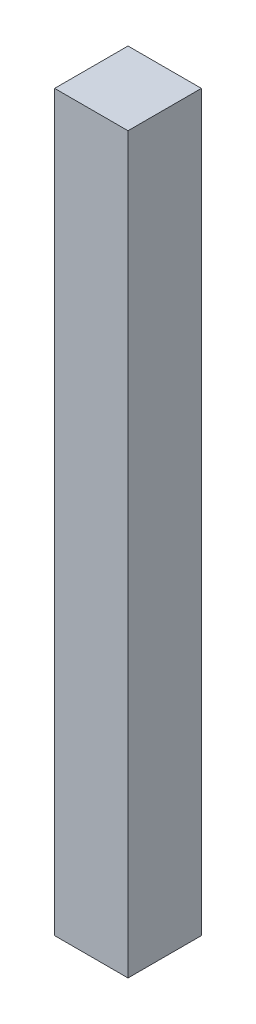
from build123d import *

# Parameters (mm, degrees)
SKETCH_1_W      = 20
SKETCH_1_H      = 20
EXTRUDE_1_DEPTH = 200


with BuildPart() as part:
    # 草图1 → 凸台-拉伸1 (new body)
    with BuildSketch(Plane(origin=(0, 0, 0), x_dir=(1, 0, 0), z_dir=(0, 1, 0))):
        with Locations((10, -10)):
            Rectangle(SKETCH_1_W, SKETCH_1_H)
    extrude(amount=EXTRUDE_1_DEPTH)


solid = part.part
